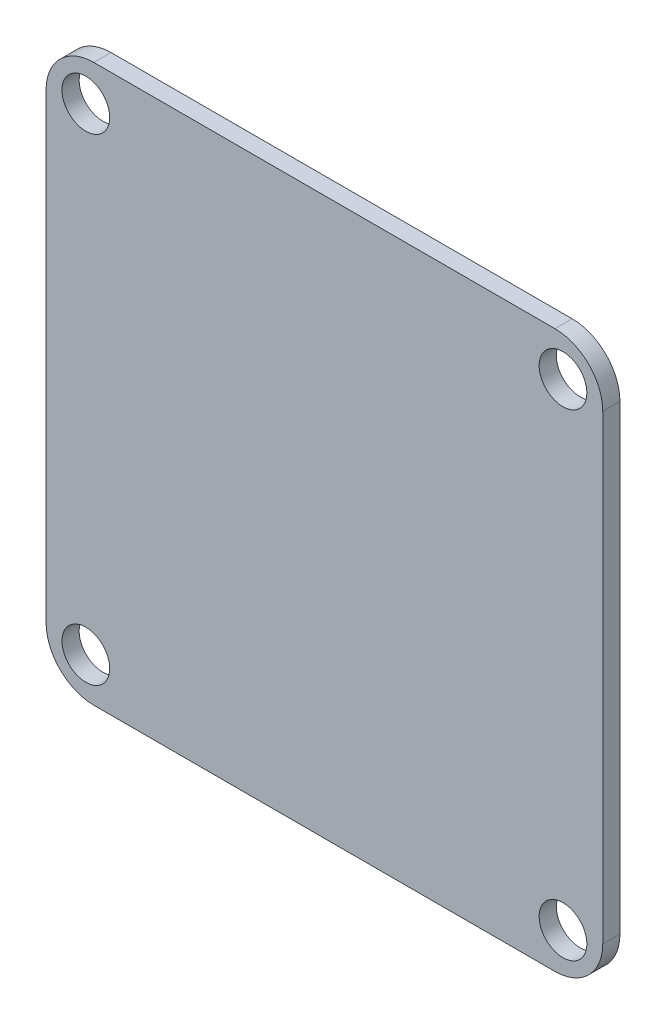
from build123d import *

# Parameters (mm, degrees)
SKETCH1_R           = 1.5
BOSS_EXTRUDE1_DEPTH = 1.08


with BuildPart() as part:
    # Sketch1 → Boss-Extrude1 (new body)
    with BuildSketch(Plane.XY):
        with BuildLine():
            Line((-14.5, -17.5), (14.5, -17.5))
            ThreePointArc((14.5, -17.5), (16.621320344, -16.621320344), (17.5, -14.5))
            Line((17.5, -14.5), (17.5, 14.5))
            ThreePointArc((17.5, 14.5), (16.621320344, 16.621320344), (14.5, 17.5))
            Line((14.5, 17.5), (-14.5, 17.5))
            ThreePointArc((-14.5, 17.5), (-16.621320344, 16.621320344), (-17.5, 14.5))
            Line((-17.5, 14.5), (-17.5, -14.5))
            ThreePointArc((-17.5, -14.5), (-16.621320344, -16.621320344), (-14.5, -17.5))
        make_face()
        with Locations((-15, -15)):
            Circle(SKETCH1_R, mode=Mode.SUBTRACT)
        with Locations(Location((15, -15, 0), (0, 0, 180))):
            Circle(SKETCH1_R, mode=Mode.SUBTRACT)
        with Locations((15, 15)):
            Circle(SKETCH1_R, mode=Mode.SUBTRACT)
        with Locations(Location((-15, 15, 0), (0, 0, 180))):
            Circle(SKETCH1_R, mode=Mode.SUBTRACT)
    extrude(amount=BOSS_EXTRUDE1_DEPTH)


solid = part.part
